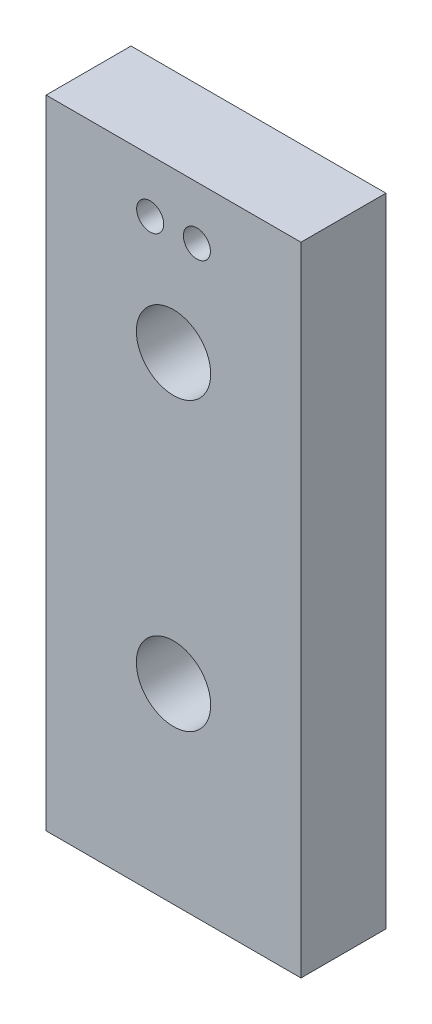
from build123d import *

# Parameters (mm, degrees)
SKETCH1_W                  = 38.1
SKETCH1_H                  = 95.25
SKETCH1_R                  = 5.55625
BOSS_EXTRUDE1_DEPTH        = 12.7
F_10_32_TAPPED_HOLE1_D     = 4.0386
F_10_32_TAPPED_HOLE1_DEPTH = 15.875
F_10_32_TAPPED_HOLE1_TIP   = 1.213317848
F_10_32_TAPPED_HOLE2_D     = 4.0386


with BuildPart() as part:
    # Sketch1 → Boss-Extrude1 (new body)
    with BuildSketch(Plane.XY):
        with Locations((0, 47.625)):
            Rectangle(SKETCH1_W, SKETCH1_H)
        with Locations((0, 28.575)):
            Circle(SKETCH1_R, mode=Mode.SUBTRACT)
        with Locations((0, 71.4375)):
            Circle(SKETCH1_R, mode=Mode.SUBTRACT)
    extrude(amount=BOSS_EXTRUDE1_DEPTH)

    # #10-32 Tapped Hole1
    with Locations(Plane(origin=(0, 0, 0), x_dir=(-1, 0, 0), z_dir=(0, -1, 0))):
        with Locations((13.97, -6.35), (-13.97, -6.35)):
            Hole(F_10_32_TAPPED_HOLE1_D / 2, depth=F_10_32_TAPPED_HOLE1_DEPTH)
            with Locations((0, 0, -(F_10_32_TAPPED_HOLE1_DEPTH + F_10_32_TAPPED_HOLE1_TIP / 2))):  # 118° drill point
                Cone(0, F_10_32_TAPPED_HOLE1_D / 2, F_10_32_TAPPED_HOLE1_TIP, mode=Mode.SUBTRACT)

    # #10-32 Tapped Hole2 (through all)
    with Locations(Plane.XY.offset(12.7)):
        with Locations((-3.4925, 87.3125), (3.4925, 87.3125)):
            Hole(F_10_32_TAPPED_HOLE2_D / 2)


solid = part.part
